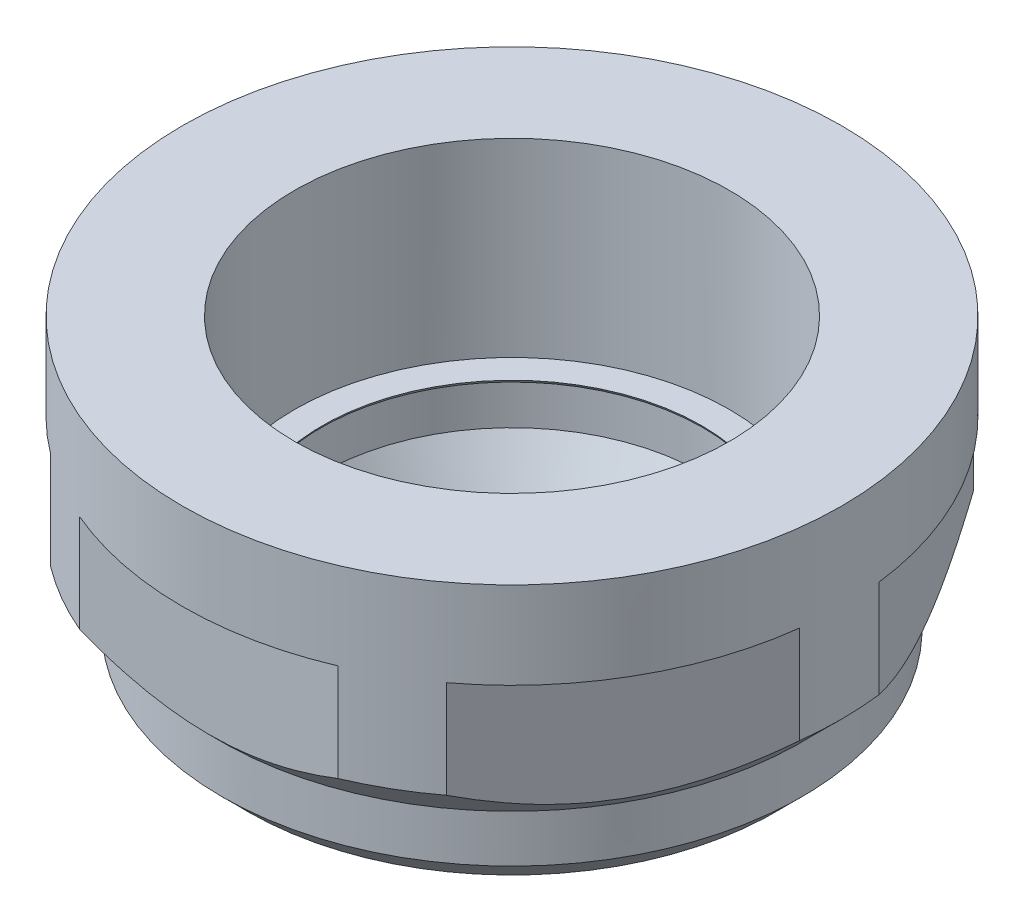
from build123d import *

# Parameters (mm, degrees)
HOLE_THREAD_D          = 16.5
HOLE_THREAD_DEPTH      = 7.2
SKETCH5_W              = 14
SKETCH5_H              = 1
EXTRUDE_CUT_DEPTH      = 8
CIRCULAR_PATTERN_COUNT = 6


with BuildPart() as part:
    # Sketch0 → Rotation1 (revolve)
    with BuildSketch(Plane.XY, mode=Mode.PRIVATE) as rotation1_sk:
        Polygon((-12.5, 11.3), (-12.5, 4.3), (-11, 2.8), (-11, 1), (-10, 0), (0, 0), (0, 11.3), align=None)
    revolve(rotation1_sk.sketch.rotate(Axis((0, 0, 0), (0, 1, 0)), 270), axis=Axis((0, 0, 0), (0, 1, 0)))

    # Sketch1 → Revolved Cut1 (revolve, cut)
    with BuildSketch(Plane(origin=(0, 0, 0), x_dir=(0, 0, -1), z_dir=(1, 0, 0)), mode=Mode.PRIVATE) as revolved_cut1_sk:
        Polygon((-5.806624327, 0), (-7.25, 2.5), (-7.25, 4), (-7.192264973, 4.1), (0, 4.1), (0, 0), align=None)
    revolve(revolved_cut1_sk.sketch.rotate(Axis((0, 0, 0), (0, 1, 0)), 180), axis=Axis((0, 0, 0), (0, 1, 0)), mode=Mode.SUBTRACT)

    # Hole/Thread
    with Locations(Plane(origin=(0, 11.3, 0), x_dir=(-1, 0, 0), z_dir=(0, 1, 0))):
        with Locations((0, 0)):
            Hole(HOLE_THREAD_D / 2, depth=HOLE_THREAD_DEPTH)

    # Sketch5 → Extrude Cut (cut)
    with BuildSketch(Plane.XZ):
        with Locations((0, 12)):
            Rectangle(SKETCH5_W, SKETCH5_H)
    extrude_cut = extrude(amount=-EXTRUDE_CUT_DEPTH, mode=Mode.SUBTRACT)

    # Circular Pattern: Extrude Cut ×6 about axis
    circular_pattern_axis = Axis((0, 0, 0), (0, 1, 0))
    for i in range(1, CIRCULAR_PATTERN_COUNT):
        add(extrude_cut.rotate(circular_pattern_axis, i * 360 / CIRCULAR_PATTERN_COUNT), mode=Mode.SUBTRACT)


solid = part.part
